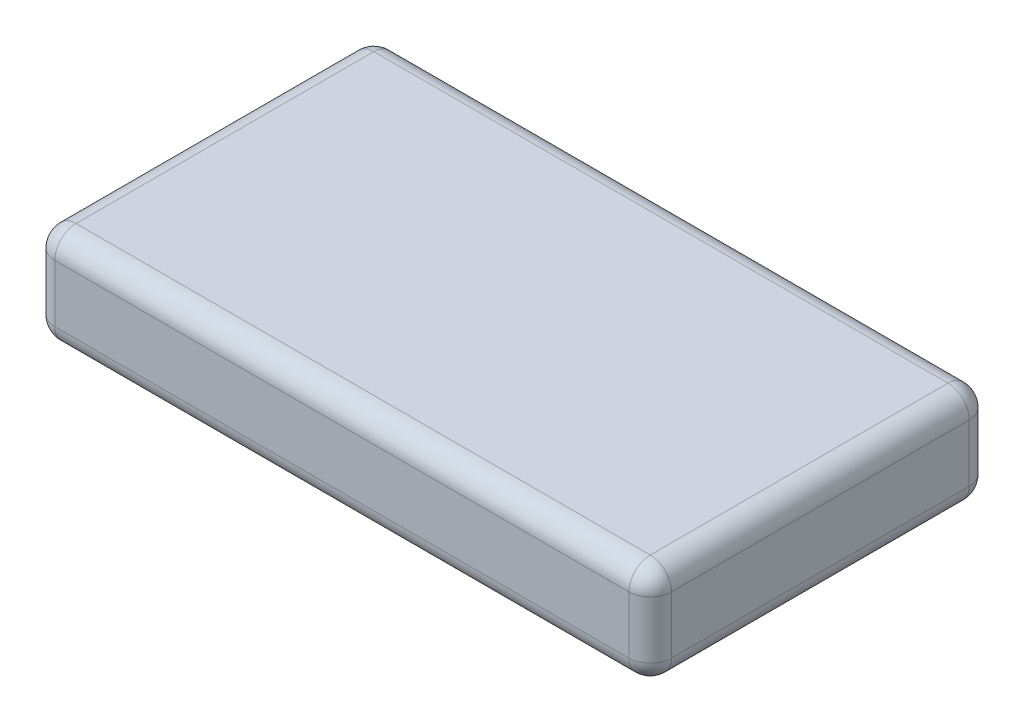
from build123d import *

# Parameters (mm, degrees)
SKETCH1_W           = 58
SKETCH1_H           = 32
BOSS_EXTRUDE1_DEPTH = 9.4
FILLET1_R           = 2


with BuildPart() as part:
    # Sketch1 → Boss-Extrude1 (new body)
    with BuildSketch(Plane(origin=(0, 0, 0), x_dir=(1, 0, 0), z_dir=(0, 1, 0))):
        Rectangle(SKETCH1_W, SKETCH1_H)
    extrude(amount=BOSS_EXTRUDE1_DEPTH)

    # Fillet1
    fillet1_edges = [part.edges().sort_by_distance(p)[0] for p in [
        (-29, 9.4, 0),
        (0, 9.4, 16),
        (29, 9.4, 0),
        (0, 0, 16),
        (-29, 0, 0),
        (0, 0, -16),
        (29, 0, 0),
        (0, 9.4, -16),
        (29, 4.7, 16),
        (-29, 4.7, 16),
        (-29, 4.7, -16),
        (29, 4.7, -16),
    ]]
    fillet(fillet1_edges, radius=FILLET1_R)


solid = part.part
